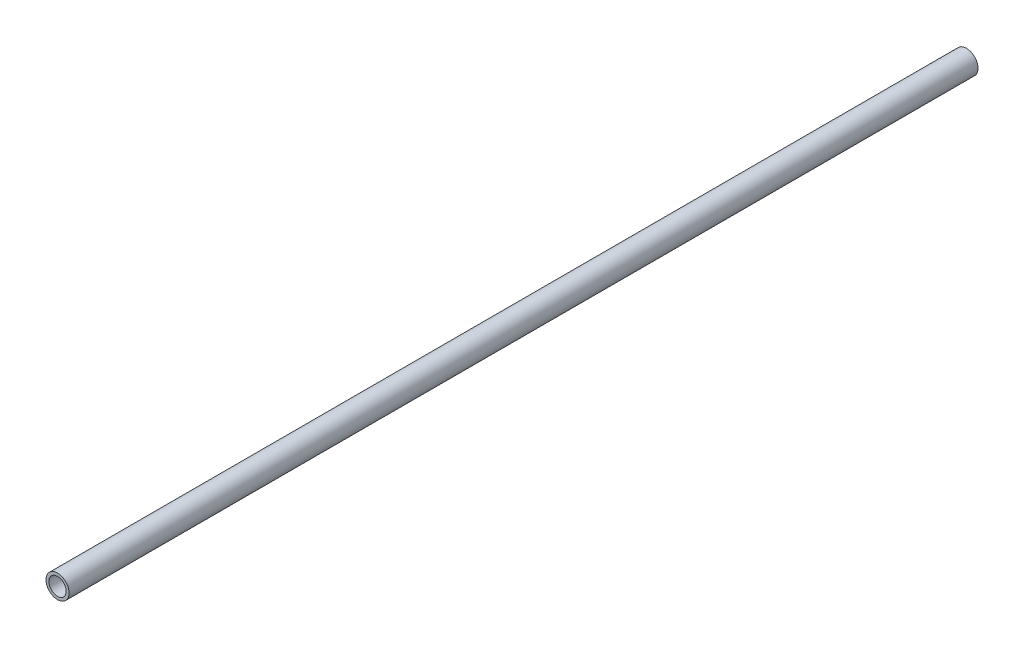
from build123d import *

# Parameters (mm, degrees)
SKETCH1_R      = 6.35
SKETCH1_R_2    = 4.7625
EXTRUDE1_DEPTH = 500


with BuildPart() as part:
    # Sketch1 → Extrude1 (new body)
    with BuildSketch(Plane.XY):
        Circle(SKETCH1_R)
        Circle(SKETCH1_R_2, mode=Mode.SUBTRACT)
    extrude(amount=EXTRUDE1_DEPTH)


solid = part.part
